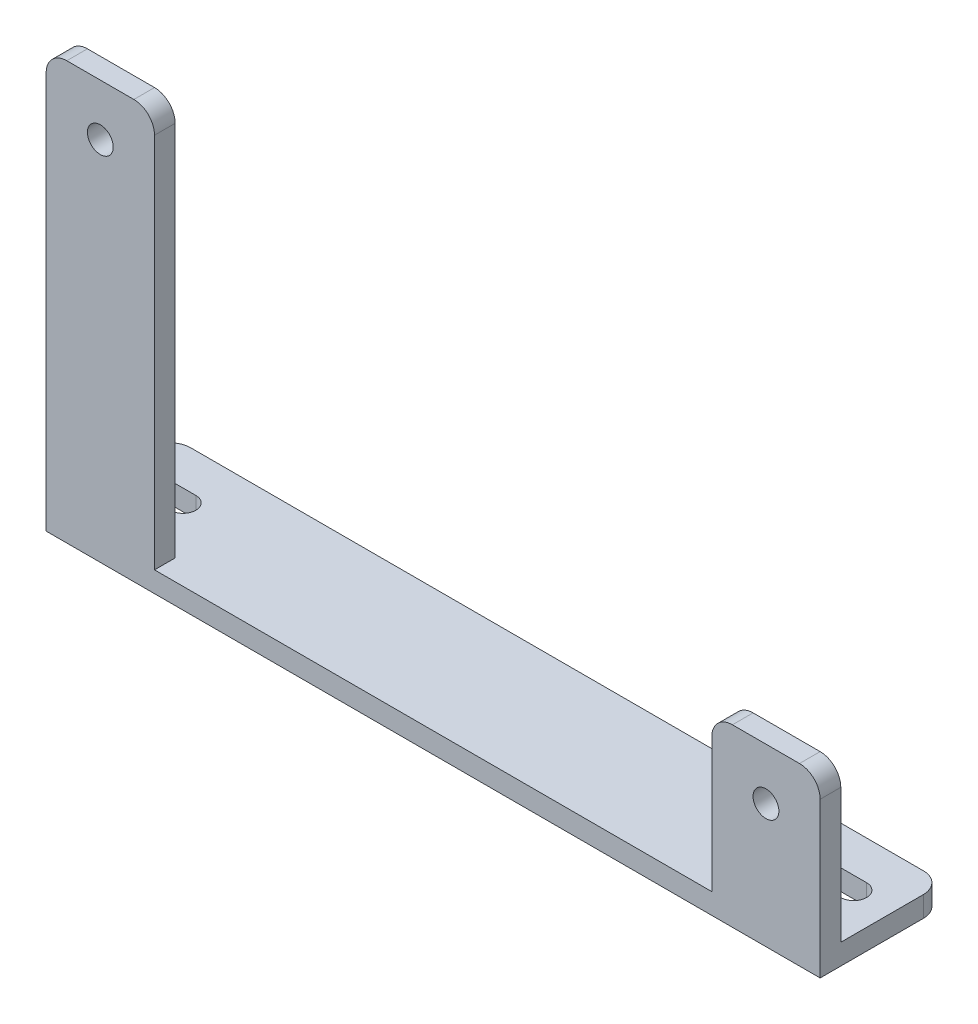
from build123d import *

# Parameters (mm, degrees)
SKETCH1_W           = 150
SKETCH1_H           = 20
BOSS_EXTRUDE1_DEPTH = 4
SKETCH2_W           = 21
SKETCH2_H           = 76.95216022
SKETCH2_R           = 2.5
SKETCH2_H_2         = 4
SKETCH2_W_2         = 108
SKETCH2_H_3         = 30
BOSS_EXTRUDE2_DEPTH = 4
FILLET1_R           = 4


with BuildPart() as part:
    # Sketch1 → Boss-Extrude1 (new body)
    with BuildSketch(Plane(origin=(0, 0, 0), x_dir=(1, 0, 0), z_dir=(0, 1, 0))):
        Rectangle(SKETCH1_W, SKETCH1_H)
        with BuildLine():
            Line((-67.5, 2.5), (-62.5, 2.5))
            ThreePointArc((-62.5, 2.5), (-60, 0), (-62.5, -2.5))
            Line((-62.5, -2.5), (-67.5, -2.5))
            ThreePointArc((-67.5, -2.5), (-70, 0), (-67.5, 2.5))
        make_face(mode=Mode.SUBTRACT)
        with BuildLine():
            Line((62.5, 2.5), (67.5, 2.5))
            ThreePointArc((67.5, 2.5), (70, 0), (67.5, -2.5))
            Line((67.5, -2.5), (62.5, -2.5))
            ThreePointArc((62.5, -2.5), (60, 0), (62.5, 2.5))
        make_face(mode=Mode.SUBTRACT)
    extrude(amount=BOSS_EXTRUDE1_DEPTH)

    # Sketch2 → Boss-Extrude2 (add)
    # profile 1 of 5: a face of its own
    with BuildSketch(Plane.XY.offset(10)):
        with Locations((-64.5, 42.47608011)):
            Rectangle(SKETCH2_W, SKETCH2_H)
        with Locations((-64.5, 70.95216022)):
            Circle(SKETCH2_R, mode=Mode.SUBTRACT)
    # profile 2 of 5: a face of its own
    with BuildSketch(Plane.XY.offset(10)):
        with Locations((-64.5, 2)):
            Rectangle(SKETCH2_W, SKETCH2_H_2)
    # profile 3 of 5: a face of its own
    with BuildSketch(Plane.XY.offset(10)):
        with Locations((0, 2)):
            Rectangle(SKETCH2_W_2, SKETCH2_H_2)
    # profile 4 of 5: a face of its own
    with BuildSketch(Plane.XY.offset(10)):
        with Locations((64.5, 2)):
            Rectangle(SKETCH2_W, SKETCH2_H_2)
    # profile 5 of 5: a face of its own
    with BuildSketch(Plane.XY.offset(10)):
        with Locations((64.5, 19)):
            Rectangle(SKETCH2_W, SKETCH2_H_3)
        with Locations((64.5, 24)):
            Circle(SKETCH2_R, mode=Mode.SUBTRACT)
    extrude(amount=BOSS_EXTRUDE2_DEPTH)

    # Fillet1
    fillet1_edges = [part.edges().sort_by_distance(p)[0] for p in [
        (-75, 80.95216022, 12),
        (75, 34, 12),
        (54, 34, 12),
        (-54, 80.95216022, 12),
        (-75, 2, -10),
        (75, 2, -10),
    ]]
    fillet(fillet1_edges, radius=FILLET1_R)


solid = part.part
